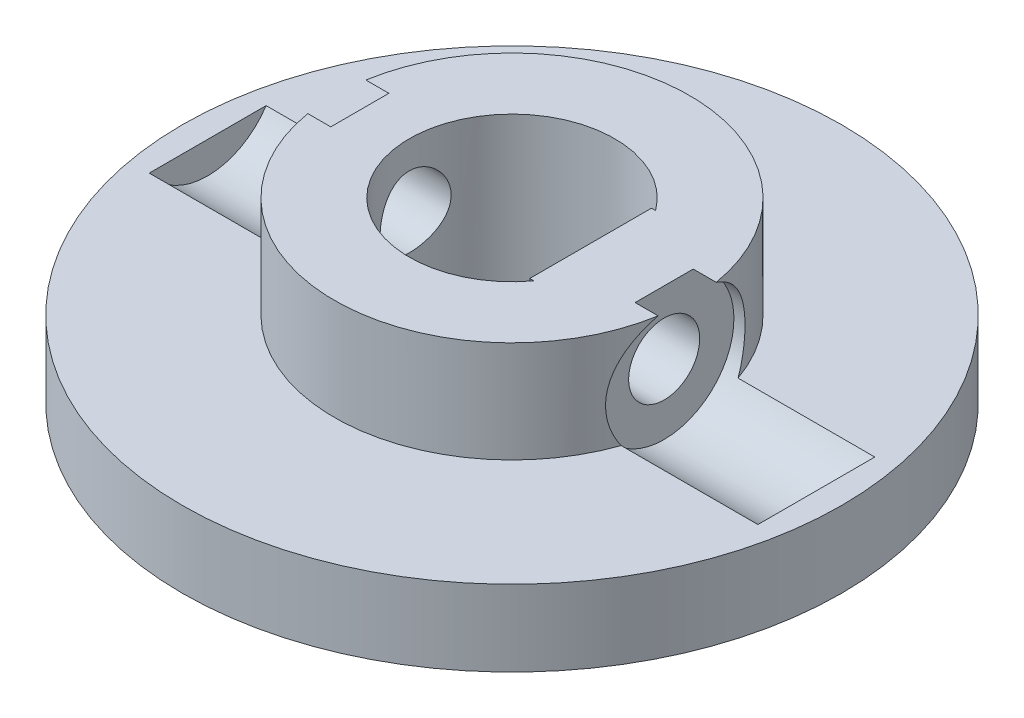
from build123d import *

# Parameters (mm, degrees)
STOCK_HORN_DRIVE_FLANGE_START                 = 41
STOCK_HORN_DRIVE_FLANGE_PROFILE_R             = 13
STOCK_HORN_DRIVE_FLANGE_PROFILE_R_2           = 4.05
STOCK_HORN_DRIVE_FLANGE_DEPTH                 = 3
D_COUPLING_RING_START                         = 44
D_COUPLING_RING_PROFILE_R                     = 7
D_COUPLING_RING_PROFILE_R_2                   = 4.05
D_COUPLING_RING_DEPTH                         = 4
D_KEY_LAND_START                              = 44
D_KEY_LAND_PROFILE_W                          = 2.9
D_KEY_LAND_PROFILE_H                          = 4.8
D_KEY_LAND_DEPTH                              = 4
YAW_POSITIVE_RETENTION_CROSSBOLT_START        = -10
YAW_POSITIVE_RETENTION_CROSSBOLT_PROFILE_R    = 1.1
YAW_POSITIVE_RETENTION_CROSSBOLT_DEPTH        = 62.400389104
CROSSBOLT_FLAT_SEAT_CUT_12_START              = -12
CROSSBOLT_FLAT_SEAT_12_R                      = 2.75
CROSSBOLT_FLAT_SEAT_CUT_12_DEPTH              = 6
CROSSBOLT_FLAT_SEAT_CUT_6_START               = 6
CROSSBOLT_FLAT_SEAT_6_R                       = 2.75
CROSSBOLT_FLAT_SEAT_CUT_6_DEPTH               = 6
SG90_SPLINE_SOCKET_BOSS_OD12_START            = 37.3
SG90_SPLINE_SOCKET_BOSS_PROFILE_R             = 6
SG90_SPLINE_SOCKET_BOSS_OD12_DEPTH            = 3.7
SG90_SPLINE_PRESS_SOCKET_D4P85_DEPTH2P5_START = 37.3
SG90_SPLINE_PRESS_SOCKET_D4P85_DEPTH_2_R      = 2.425
SG90_SPLINE_PRESS_SOCKET_D4P85_DEPTH2P5_DEPTH = 2.5
SG90_CENTRE_SCREW_CLEARANCE_D2P4_START        = 39.8
SG90_CENTRE_SCREW_CLEARANCE_D2P4_PROFILE_R    = 1.2
SG90_CENTRE_SCREW_CLEARANCE_D2P4_DEPTH        = 1.2
CROSSBOLT_AXIAL_FLOAT_CLEARANCE_D2P8_START    = -10
CROSSBOLT_AXIAL_FLOAT_CLEARANCE_D2P8_PRO_R    = 1.4
CROSSBOLT_AXIAL_FLOAT_CLEARANCE_D2P8_DEPTH    = 62.400389197


with BuildPart() as part:
    # Stock_horn_drive_flange_profile → Stock_horn_drive_flange (new body)
    with BuildSketch(Plane(origin=(0, 0, 0), x_dir=(1, 0, 0), z_dir=(0, 1, 0)).offset(STOCK_HORN_DRIVE_FLANGE_START)):
        with Locations(Location((0, 0, 0), (0, 0, 270))):
            Circle(STOCK_HORN_DRIVE_FLANGE_PROFILE_R)
        with Locations(Location((0, 0, 0), (0, 0, 270))):
            Circle(STOCK_HORN_DRIVE_FLANGE_PROFILE_R_2, mode=Mode.SUBTRACT)
    extrude(amount=STOCK_HORN_DRIVE_FLANGE_DEPTH)

    # D_coupling_ring_profile → D_coupling_ring (add)
    with BuildSketch(Plane(origin=(0, 0, 0), x_dir=(1, 0, 0), z_dir=(0, 1, 0)).offset(D_COUPLING_RING_START)):
        with Locations(Location((0, 0, 0), (0, 0, 270))):
            Circle(D_COUPLING_RING_PROFILE_R)
        with Locations(Location((0, 0, 0), (0, 0, 270))):
            Circle(D_COUPLING_RING_PROFILE_R_2, mode=Mode.SUBTRACT)
    extrude(amount=D_COUPLING_RING_DEPTH)

    # D_key_land_profile → D_key_land (add)
    with BuildSketch(Plane(origin=(0, 0, 0), x_dir=(1, 0, 0), z_dir=(0, 1, 0)).offset(D_KEY_LAND_START)):
        with Locations((4.55, 0)):
            Rectangle(D_KEY_LAND_PROFILE_W, D_KEY_LAND_PROFILE_H)
    extrude(amount=D_KEY_LAND_DEPTH)

    # Yaw_positive_retention_crossbolt_profile → Yaw_positive_retention_crossbolt (cut, through all)
    with BuildSketch(Plane(origin=(0, 0, 0), x_dir=(0, 0, -1), z_dir=(1, 0, 0)).offset(YAW_POSITIVE_RETENTION_CROSSBOLT_START)):
        with Locations(Location((0, 45.5, 0), (0, 0, 180))):
            Circle(YAW_POSITIVE_RETENTION_CROSSBOLT_PROFILE_R)
    extrude(amount=YAW_POSITIVE_RETENTION_CROSSBOLT_DEPTH, mode=Mode.SUBTRACT)

    # Crossbolt_flat_seat_-12 → Crossbolt_flat_seat_cut_-12 (cut)
    with BuildSketch(Plane(origin=(0, 0, 0), x_dir=(0, 0, -1), z_dir=(1, 0, 0)).offset(CROSSBOLT_FLAT_SEAT_CUT_12_START)):
        with Locations((0, 45.5)):
            Circle(CROSSBOLT_FLAT_SEAT_12_R)
    extrude(amount=CROSSBOLT_FLAT_SEAT_CUT_12_DEPTH, mode=Mode.SUBTRACT)

    # Crossbolt_flat_seat_6 → Crossbolt_flat_seat_cut_6 (cut)
    with BuildSketch(Plane(origin=(0, 0, 0), x_dir=(0, 0, -1), z_dir=(1, 0, 0)).offset(CROSSBOLT_FLAT_SEAT_CUT_6_START)):
        with Locations((0, 45.5)):
            Circle(CROSSBOLT_FLAT_SEAT_6_R)
    extrude(amount=CROSSBOLT_FLAT_SEAT_CUT_6_DEPTH, mode=Mode.SUBTRACT)

    # SG90_spline_socket_boss_profile → SG90_spline_socket_boss_OD12 (add)
    with BuildSketch(Plane(origin=(0, 0, 0), x_dir=(1, 0, 0), z_dir=(0, 1, 0)).offset(SG90_SPLINE_SOCKET_BOSS_OD12_START)):
        with Locations(Location((0, 0, 0), (0, 0, 270))):
            Circle(SG90_SPLINE_SOCKET_BOSS_PROFILE_R)
    extrude(amount=SG90_SPLINE_SOCKET_BOSS_OD12_DEPTH)

    # SG90_spline_press_socket_D4p85_depth 2 → SG90_spline_press_socket_D4p85_depth2p5 (cut)
    with BuildSketch(Plane(origin=(0, 0, 0), x_dir=(1, 0, 0), z_dir=(0, 1, 0)).offset(SG90_SPLINE_PRESS_SOCKET_D4P85_DEPTH2P5_START)):
        with Locations(Location((0, 0, 0), (0, 0, 270))):
            Circle(SG90_SPLINE_PRESS_SOCKET_D4P85_DEPTH_2_R)
    extrude(amount=SG90_SPLINE_PRESS_SOCKET_D4P85_DEPTH2P5_DEPTH, mode=Mode.SUBTRACT)

    # SG90_centre_screw_clearance_D2p4_profile → SG90_centre_screw_clearance_D2p4 (cut)
    with BuildSketch(Plane(origin=(0, 0, 0), x_dir=(1, 0, 0), z_dir=(0, 1, 0)).offset(SG90_CENTRE_SCREW_CLEARANCE_D2P4_START)):
        with Locations(Location((0, 0, 0), (0, 0, 270))):
            Circle(SG90_CENTRE_SCREW_CLEARANCE_D2P4_PROFILE_R)
    extrude(amount=SG90_CENTRE_SCREW_CLEARANCE_D2P4_DEPTH, mode=Mode.SUBTRACT)

    # Crossbolt_axial_float_clearance_D2p8_profile → Crossbolt_axial_float_clearance_D2p8 (cut, through all)
    with BuildSketch(Plane(origin=(0, 0, 0), x_dir=(0, 0, -1), z_dir=(1, 0, 0)).offset(CROSSBOLT_AXIAL_FLOAT_CLEARANCE_D2P8_START)):
        with Locations((0, 45.5)):
            Circle(CROSSBOLT_AXIAL_FLOAT_CLEARANCE_D2P8_PRO_R)
    extrude(amount=CROSSBOLT_AXIAL_FLOAT_CLEARANCE_D2P8_DEPTH, mode=Mode.SUBTRACT)


solid = part.part
